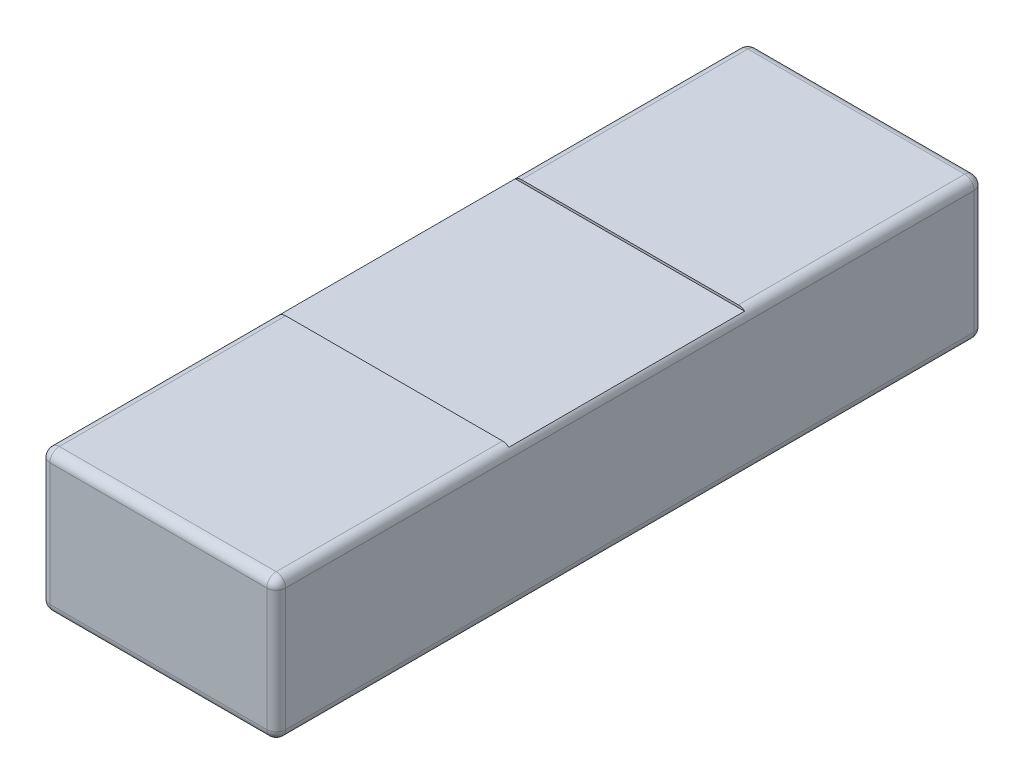
from build123d import *

# Parameters (mm, degrees)
SKETCH2_W           = 50
SKETCH2_H           = 150
BOSS_EXTRUDE1_DEPTH = 30
FILLET1_R           = 2
SKETCH3_W           = 99.739454276
SKETCH3_H           = 50
CUT_EXTRUDE1_DEPTH  = 0.5
SKETCH4_W           = 84.567654974
SKETCH4_H           = 50
CUT_EXTRUDE2_DEPTH  = 0.5


with BuildPart() as part:
    # Sketch2 → Boss-Extrude1 (new body)
    with BuildSketch(Plane(origin=(0, 0, 0), x_dir=(1, 0, 0), z_dir=(0, 1, 0))):
        Rectangle(SKETCH2_W, SKETCH2_H)
    extrude(amount=BOSS_EXTRUDE1_DEPTH)

    # Fillet1
    fillet1_edges = [part.edges().sort_by_distance(p)[0] for p in [
        (-25, 30, 0),
        (0, 30, 75),
        (25, 30, 0),
        (0, 0, 75),
        (-25, 0, 0),
        (0, 0, -75),
        (25, 0, 0),
        (25, 15, 75),
        (-25, 15, 75),
        (-25, 15, -75),
        (25, 15, -75),
        (0, 30, -75),
    ]]
    fillet(fillet1_edges, radius=FILLET1_R)

    # Sketch3 → Cut-Extrude1 (cut)
    with BuildSketch(Plane(origin=(0, 30, 0), x_dir=(1, 0, 0), z_dir=(0, 1, 0))):
        Rectangle(SKETCH3_W, SKETCH3_H)
    extrude(amount=-CUT_EXTRUDE1_DEPTH, mode=Mode.SUBTRACT)

    # Sketch4 → Cut-Extrude2 (cut)
    with BuildSketch(Plane.XZ):
        Rectangle(SKETCH4_W, SKETCH4_H)
    extrude(amount=-CUT_EXTRUDE2_DEPTH, mode=Mode.SUBTRACT)


solid = part.part
